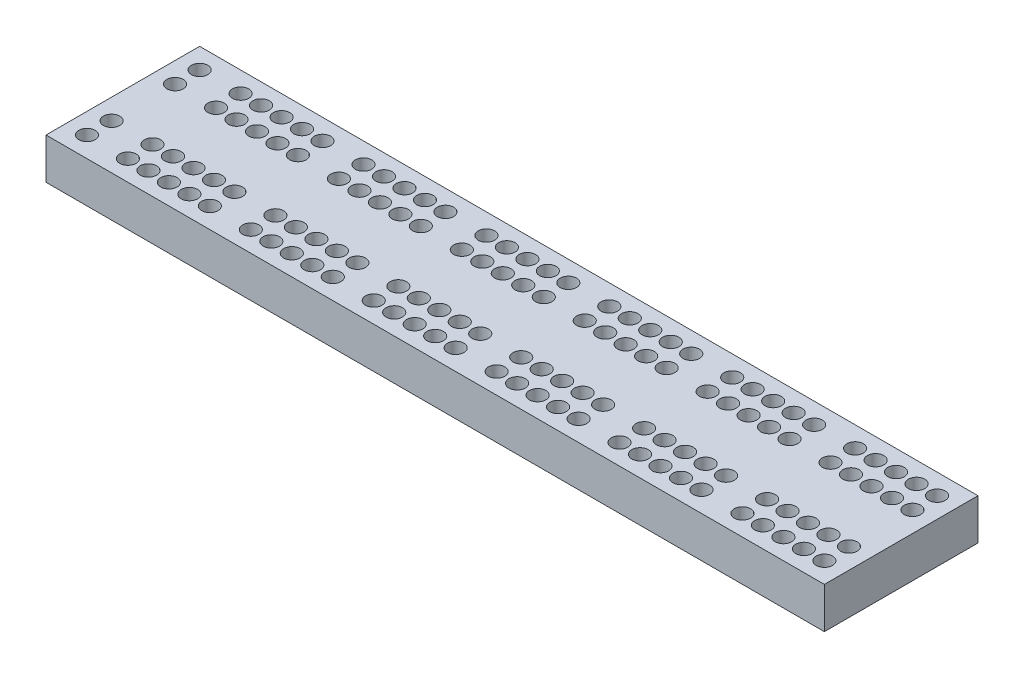
from build123d import *

# Parameters (mm, degrees)
SKETCH1_W            = 75
SKETCH1_H            = 20
BOSS_EXTRUDE1_DEPTH  = 190
LPATTERN1_COUNT      = 37
LPATTERN1_PITCH      = 10
LPATTERN1_COUNT_DIR2 = 2
LPATTERN1_PITCH_DIR2 = 12


with BuildPart() as part:
    # Sketch1 → Boss-Extrude1 (new, symmetric)
    with BuildSketch(Plane(origin=(0, 0, 0), x_dir=(0, 0, -1), z_dir=(1, 0, 0))):
        Rectangle(SKETCH1_W, SKETCH1_H)
    extrude(amount=BOSS_EXTRUDE1_DEPTH, both=True)

    # Sketch2 → Ø8.0 (8) Diameter Hole1 (revolve, cut)
    with BuildSketch(Plane(origin=(-180, 10, -27.5), x_dir=(0, 0, 1), z_dir=(1, 0, 0))):
        Polygon((0, 0), (0, 14.403442476), (4, 12), (4, 0), align=None)
    f_8_0_8_diameter_hole1 = revolve(axis=Axis((-180, 16.35, -27.5), (0, -1, 0)), mode=Mode.SUBTRACT)

    # LPattern1: 8.0 _8_ Diameter Hole1 37 × 2, 12 skipped
    with Locations(*[(i * LPATTERN1_PITCH, 0, j * LPATTERN1_PITCH_DIR2) for i in range(LPATTERN1_COUNT) for j in range(LPATTERN1_COUNT_DIR2) if (i, j) not in ((0, 0), (1, 0), (1, 1), (7, 0), (7, 1), (13, 0), (13, 1), (19, 0), (19, 1), (25, 0), (25, 1), (31, 0), (31, 1))]):
        add(f_8_0_8_diameter_hole1, mode=Mode.SUBTRACT)

    # Mirror1: Ø8.0 (8) Diameter Hole1 across plane
    add(f_8_0_8_diameter_hole1.mirror(Plane.XY), mode=Mode.SUBTRACT)

    # Mirror1 copy 1 sketch → Mirror1 copy 1 (revolve, cut)
    with BuildSketch(Plane(origin=(-180, 10, 15.5), x_dir=(0, 0, -1), z_dir=(1, 0, 0))):
        Polygon((0, 0), (0, -14.403442476), (4, -12), (4, 0), align=None)
    revolve(axis=Axis((-180, 16.35, 15.5), (0, 1, 0)), mode=Mode.SUBTRACT)

    # Mirror1 copy 2 sketch → Mirror1 copy 2 (revolve, cut)
    with BuildSketch(Plane(origin=(-160, 10, 27.5), x_dir=(0, 0, -1), z_dir=(1, 0, 0))):
        Polygon((0, 0), (0, -14.403442476), (4, -12), (4, 0), align=None)
    revolve(axis=Axis((-160, 16.35, 27.5), (0, 1, 0)), mode=Mode.SUBTRACT)

    # Mirror1 copy 3 sketch → Mirror1 copy 3 (revolve, cut)
    with BuildSketch(Plane(origin=(-160, 10, 15.5), x_dir=(0, 0, -1), z_dir=(1, 0, 0))):
        Polygon((0, 0), (0, -14.403442476), (4, -12), (4, 0), align=None)
    revolve(axis=Axis((-160, 16.35, 15.5), (0, 1, 0)), mode=Mode.SUBTRACT)

    # Mirror1 copy 4 sketch → Mirror1 copy 4 (revolve, cut)
    with BuildSketch(Plane(origin=(-150, 10, 27.5), x_dir=(0, 0, -1), z_dir=(1, 0, 0))):
        Polygon((0, 0), (0, -14.403442476), (4, -12), (4, 0), align=None)
    revolve(axis=Axis((-150, 16.35, 27.5), (0, 1, 0)), mode=Mode.SUBTRACT)

    # Mirror1 copy 5 sketch → Mirror1 copy 5 (revolve, cut)
    with BuildSketch(Plane(origin=(-150, 10, 15.5), x_dir=(0, 0, -1), z_dir=(1, 0, 0))):
        Polygon((0, 0), (0, -14.403442476), (4, -12), (4, 0), align=None)
    revolve(axis=Axis((-150, 16.35, 15.5), (0, 1, 0)), mode=Mode.SUBTRACT)

    # Mirror1 copy 6 sketch → Mirror1 copy 6 (revolve, cut)
    with BuildSketch(Plane(origin=(-140, 10, 27.5), x_dir=(0, 0, -1), z_dir=(1, 0, 0))):
        Polygon((0, 0), (0, -14.403442476), (4, -12), (4, 0), align=None)
    revolve(axis=Axis((-140, 16.35, 27.5), (0, 1, 0)), mode=Mode.SUBTRACT)

    # Mirror1 copy 7 sketch → Mirror1 copy 7 (revolve, cut)
    with BuildSketch(Plane(origin=(-140, 10, 15.5), x_dir=(0, 0, -1), z_dir=(1, 0, 0))):
        Polygon((0, 0), (0, -14.403442476), (4, -12), (4, 0), align=None)
    revolve(axis=Axis((-140, 16.35, 15.5), (0, 1, 0)), mode=Mode.SUBTRACT)

    # Mirror1 copy 8 sketch → Mirror1 copy 8 (revolve, cut)
    with BuildSketch(Plane(origin=(-130, 10, 27.5), x_dir=(0, 0, -1), z_dir=(1, 0, 0))):
        Polygon((0, 0), (0, -14.403442476), (4, -12), (4, 0), align=None)
    revolve(axis=Axis((-130, 16.35, 27.5), (0, 1, 0)), mode=Mode.SUBTRACT)

    # Mirror1 copy 9 sketch → Mirror1 copy 9 (revolve, cut)
    with BuildSketch(Plane(origin=(-130, 10, 15.5), x_dir=(0, 0, -1), z_dir=(1, 0, 0))):
        Polygon((0, 0), (0, -14.403442476), (4, -12), (4, 0), align=None)
    revolve(axis=Axis((-130, 16.35, 15.5), (0, 1, 0)), mode=Mode.SUBTRACT)

    # Mirror1 copy 10 sketch → Mirror1 copy 10 (revolve, cut)
    with BuildSketch(Plane(origin=(-120, 10, 27.5), x_dir=(0, 0, -1), z_dir=(1, 0, 0))):
        Polygon((0, 0), (0, -14.403442476), (4, -12), (4, 0), align=None)
    revolve(axis=Axis((-120, 16.35, 27.5), (0, 1, 0)), mode=Mode.SUBTRACT)

    # Mirror1 copy 11 sketch → Mirror1 copy 11 (revolve, cut)
    with BuildSketch(Plane(origin=(-120, 10, 15.5), x_dir=(0, 0, -1), z_dir=(1, 0, 0))):
        Polygon((0, 0), (0, -14.403442476), (4, -12), (4, 0), align=None)
    revolve(axis=Axis((-120, 16.35, 15.5), (0, 1, 0)), mode=Mode.SUBTRACT)

    # Mirror1 copy 12 sketch → Mirror1 copy 12 (revolve, cut)
    with BuildSketch(Plane(origin=(-100, 10, 27.5), x_dir=(0, 0, -1), z_dir=(1, 0, 0))):
        Polygon((0, 0), (0, -14.403442476), (4, -12), (4, 0), align=None)
    revolve(axis=Axis((-100, 16.35, 27.5), (0, 1, 0)), mode=Mode.SUBTRACT)

    # Mirror1 copy 13 sketch → Mirror1 copy 13 (revolve, cut)
    with BuildSketch(Plane(origin=(-100, 10, 15.5), x_dir=(0, 0, -1), z_dir=(1, 0, 0))):
        Polygon((0, 0), (0, -14.403442476), (4, -12), (4, 0), align=None)
    revolve(axis=Axis((-100, 16.35, 15.5), (0, 1, 0)), mode=Mode.SUBTRACT)

    # Mirror1 copy 14 sketch → Mirror1 copy 14 (revolve, cut)
    with BuildSketch(Plane(origin=(-90, 10, 27.5), x_dir=(0, 0, -1), z_dir=(1, 0, 0))):
        Polygon((0, 0), (0, -14.403442476), (4, -12), (4, 0), align=None)
    revolve(axis=Axis((-90, 16.35, 27.5), (0, 1, 0)), mode=Mode.SUBTRACT)

    # Mirror1 copy 15 sketch → Mirror1 copy 15 (revolve, cut)
    with BuildSketch(Plane(origin=(-90, 10, 15.5), x_dir=(0, 0, -1), z_dir=(1, 0, 0))):
        Polygon((0, 0), (0, -14.403442476), (4, -12), (4, 0), align=None)
    revolve(axis=Axis((-90, 16.35, 15.5), (0, 1, 0)), mode=Mode.SUBTRACT)

    # Mirror1 copy 16 sketch → Mirror1 copy 16 (revolve, cut)
    with BuildSketch(Plane(origin=(-80, 10, 27.5), x_dir=(0, 0, -1), z_dir=(1, 0, 0))):
        Polygon((0, 0), (0, -14.403442476), (4, -12), (4, 0), align=None)
    revolve(axis=Axis((-80, 16.35, 27.5), (0, 1, 0)), mode=Mode.SUBTRACT)

    # Mirror1 copy 17 sketch → Mirror1 copy 17 (revolve, cut)
    with BuildSketch(Plane(origin=(-80, 10, 15.5), x_dir=(0, 0, -1), z_dir=(1, 0, 0))):
        Polygon((0, 0), (0, -14.403442476), (4, -12), (4, 0), align=None)
    revolve(axis=Axis((-80, 16.35, 15.5), (0, 1, 0)), mode=Mode.SUBTRACT)

    # Mirror1 copy 18 sketch → Mirror1 copy 18 (revolve, cut)
    with BuildSketch(Plane(origin=(-70, 10, 27.5), x_dir=(0, 0, -1), z_dir=(1, 0, 0))):
        Polygon((0, 0), (0, -14.403442476), (4, -12), (4, 0), align=None)
    revolve(axis=Axis((-70, 16.35, 27.5), (0, 1, 0)), mode=Mode.SUBTRACT)

    # Mirror1 copy 19 sketch → Mirror1 copy 19 (revolve, cut)
    with BuildSketch(Plane(origin=(-70, 10, 15.5), x_dir=(0, 0, -1), z_dir=(1, 0, 0))):
        Polygon((0, 0), (0, -14.403442476), (4, -12), (4, 0), align=None)
    revolve(axis=Axis((-70, 16.35, 15.5), (0, 1, 0)), mode=Mode.SUBTRACT)

    # Mirror1 copy 20 sketch → Mirror1 copy 20 (revolve, cut)
    with BuildSketch(Plane(origin=(-60, 10, 27.5), x_dir=(0, 0, -1), z_dir=(1, 0, 0))):
        Polygon((0, 0), (0, -14.403442476), (4, -12), (4, 0), align=None)
    revolve(axis=Axis((-60, 16.35, 27.5), (0, 1, 0)), mode=Mode.SUBTRACT)

    # Mirror1 copy 21 sketch → Mirror1 copy 21 (revolve, cut)
    with BuildSketch(Plane(origin=(-60, 10, 15.5), x_dir=(0, 0, -1), z_dir=(1, 0, 0))):
        Polygon((0, 0), (0, -14.403442476), (4, -12), (4, 0), align=None)
    revolve(axis=Axis((-60, 16.35, 15.5), (0, 1, 0)), mode=Mode.SUBTRACT)

    # Mirror1 copy 22 sketch → Mirror1 copy 22 (revolve, cut)
    with BuildSketch(Plane(origin=(-40, 10, 27.5), x_dir=(0, 0, -1), z_dir=(1, 0, 0))):
        Polygon((0, 0), (0, -14.403442476), (4, -12), (4, 0), align=None)
    revolve(axis=Axis((-40, 16.35, 27.5), (0, 1, 0)), mode=Mode.SUBTRACT)

    # Mirror1 copy 23 sketch → Mirror1 copy 23 (revolve, cut)
    with BuildSketch(Plane(origin=(-40, 10, 15.5), x_dir=(0, 0, -1), z_dir=(1, 0, 0))):
        Polygon((0, 0), (0, -14.403442476), (4, -12), (4, 0), align=None)
    revolve(axis=Axis((-40, 16.35, 15.5), (0, 1, 0)), mode=Mode.SUBTRACT)

    # Mirror1 copy 24 sketch → Mirror1 copy 24 (revolve, cut)
    with BuildSketch(Plane(origin=(-30, 10, 27.5), x_dir=(0, 0, -1), z_dir=(1, 0, 0))):
        Polygon((0, 0), (0, -14.403442476), (4, -12), (4, 0), align=None)
    revolve(axis=Axis((-30, 16.35, 27.5), (0, 1, 0)), mode=Mode.SUBTRACT)

    # Mirror1 copy 25 sketch → Mirror1 copy 25 (revolve, cut)
    with BuildSketch(Plane(origin=(-30, 10, 15.5), x_dir=(0, 0, -1), z_dir=(1, 0, 0))):
        Polygon((0, 0), (0, -14.403442476), (4, -12), (4, 0), align=None)
    revolve(axis=Axis((-30, 16.35, 15.5), (0, 1, 0)), mode=Mode.SUBTRACT)

    # Mirror1 copy 26 sketch → Mirror1 copy 26 (revolve, cut)
    with BuildSketch(Plane(origin=(-20, 10, 27.5), x_dir=(0, 0, -1), z_dir=(1, 0, 0))):
        Polygon((0, 0), (0, -14.403442476), (4, -12), (4, 0), align=None)
    revolve(axis=Axis((-20, 16.35, 27.5), (0, 1, 0)), mode=Mode.SUBTRACT)

    # Mirror1 copy 27 sketch → Mirror1 copy 27 (revolve, cut)
    with BuildSketch(Plane(origin=(-20, 10, 15.5), x_dir=(0, 0, -1), z_dir=(1, 0, 0))):
        Polygon((0, 0), (0, -14.403442476), (4, -12), (4, 0), align=None)
    revolve(axis=Axis((-20, 16.35, 15.5), (0, 1, 0)), mode=Mode.SUBTRACT)

    # Mirror1 copy 28 sketch → Mirror1 copy 28 (revolve, cut)
    with BuildSketch(Plane(origin=(-10, 10, 27.5), x_dir=(0, 0, -1), z_dir=(1, 0, 0))):
        Polygon((0, 0), (0, -14.403442476), (4, -12), (4, 0), align=None)
    revolve(axis=Axis((-10, 16.35, 27.5), (0, 1, 0)), mode=Mode.SUBTRACT)

    # Mirror1 copy 29 sketch → Mirror1 copy 29 (revolve, cut)
    with BuildSketch(Plane(origin=(-10, 10, 15.5), x_dir=(0, 0, -1), z_dir=(1, 0, 0))):
        Polygon((0, 0), (0, -14.403442476), (4, -12), (4, 0), align=None)
    revolve(axis=Axis((-10, 16.35, 15.5), (0, 1, 0)), mode=Mode.SUBTRACT)

    # Mirror1 copy 30 sketch → Mirror1 copy 30 (revolve, cut)
    with BuildSketch(Plane(origin=(0, 10, 27.5), x_dir=(0, 0, -1), z_dir=(1, 0, 0))):
        Polygon((0, 0), (0, -14.403442476), (4, -12), (4, 0), align=None)
    revolve(axis=Axis((0, 16.35, 27.5), (0, 1, 0)), mode=Mode.SUBTRACT)

    # Mirror1 copy 31 sketch → Mirror1 copy 31 (revolve, cut)
    with BuildSketch(Plane(origin=(0, 10, 15.5), x_dir=(0, 0, -1), z_dir=(1, 0, 0))):
        Polygon((0, 0), (0, -14.403442476), (4, -12), (4, 0), align=None)
    revolve(axis=Axis((0, 16.35, 15.5), (0, 1, 0)), mode=Mode.SUBTRACT)

    # Mirror1 copy 32 sketch → Mirror1 copy 32 (revolve, cut)
    with BuildSketch(Plane(origin=(20, 10, 27.5), x_dir=(0, 0, -1), z_dir=(1, 0, 0))):
        Polygon((0, 0), (0, -14.403442476), (4, -12), (4, 0), align=None)
    revolve(axis=Axis((20, 16.35, 27.5), (0, 1, 0)), mode=Mode.SUBTRACT)

    # Mirror1 copy 33 sketch → Mirror1 copy 33 (revolve, cut)
    with BuildSketch(Plane(origin=(20, 10, 15.5), x_dir=(0, 0, -1), z_dir=(1, 0, 0))):
        Polygon((0, 0), (0, -14.403442476), (4, -12), (4, 0), align=None)
    revolve(axis=Axis((20, 16.35, 15.5), (0, 1, 0)), mode=Mode.SUBTRACT)

    # Mirror1 copy 34 sketch → Mirror1 copy 34 (revolve, cut)
    with BuildSketch(Plane(origin=(30, 10, 27.5), x_dir=(0, 0, -1), z_dir=(1, 0, 0))):
        Polygon((0, 0), (0, -14.403442476), (4, -12), (4, 0), align=None)
    revolve(axis=Axis((30, 16.35, 27.5), (0, 1, 0)), mode=Mode.SUBTRACT)

    # Mirror1 copy 35 sketch → Mirror1 copy 35 (revolve, cut)
    with BuildSketch(Plane(origin=(30, 10, 15.5), x_dir=(0, 0, -1), z_dir=(1, 0, 0))):
        Polygon((0, 0), (0, -14.403442476), (4, -12), (4, 0), align=None)
    revolve(axis=Axis((30, 16.35, 15.5), (0, 1, 0)), mode=Mode.SUBTRACT)

    # Mirror1 copy 36 sketch → Mirror1 copy 36 (revolve, cut)
    with BuildSketch(Plane(origin=(40, 10, 27.5), x_dir=(0, 0, -1), z_dir=(1, 0, 0))):
        Polygon((0, 0), (0, -14.403442476), (4, -12), (4, 0), align=None)
    revolve(axis=Axis((40, 16.35, 27.5), (0, 1, 0)), mode=Mode.SUBTRACT)

    # Mirror1 copy 37 sketch → Mirror1 copy 37 (revolve, cut)
    with BuildSketch(Plane(origin=(40, 10, 15.5), x_dir=(0, 0, -1), z_dir=(1, 0, 0))):
        Polygon((0, 0), (0, -14.403442476), (4, -12), (4, 0), align=None)
    revolve(axis=Axis((40, 16.35, 15.5), (0, 1, 0)), mode=Mode.SUBTRACT)

    # Mirror1 copy 38 sketch → Mirror1 copy 38 (revolve, cut)
    with BuildSketch(Plane(origin=(50, 10, 27.5), x_dir=(0, 0, -1), z_dir=(1, 0, 0))):
        Polygon((0, 0), (0, -14.403442476), (4, -12), (4, 0), align=None)
    revolve(axis=Axis((50, 16.35, 27.5), (0, 1, 0)), mode=Mode.SUBTRACT)

    # Mirror1 copy 39 sketch → Mirror1 copy 39 (revolve, cut)
    with BuildSketch(Plane(origin=(50, 10, 15.5), x_dir=(0, 0, -1), z_dir=(1, 0, 0))):
        Polygon((0, 0), (0, -14.403442476), (4, -12), (4, 0), align=None)
    revolve(axis=Axis((50, 16.35, 15.5), (0, 1, 0)), mode=Mode.SUBTRACT)

    # Mirror1 copy 40 sketch → Mirror1 copy 40 (revolve, cut)
    with BuildSketch(Plane(origin=(60, 10, 27.5), x_dir=(0, 0, -1), z_dir=(1, 0, 0))):
        Polygon((0, 0), (0, -14.403442476), (4, -12), (4, 0), align=None)
    revolve(axis=Axis((60, 16.35, 27.5), (0, 1, 0)), mode=Mode.SUBTRACT)

    # Mirror1 copy 41 sketch → Mirror1 copy 41 (revolve, cut)
    with BuildSketch(Plane(origin=(60, 10, 15.5), x_dir=(0, 0, -1), z_dir=(1, 0, 0))):
        Polygon((0, 0), (0, -14.403442476), (4, -12), (4, 0), align=None)
    revolve(axis=Axis((60, 16.35, 15.5), (0, 1, 0)), mode=Mode.SUBTRACT)

    # Mirror1 copy 42 sketch → Mirror1 copy 42 (revolve, cut)
    with BuildSketch(Plane(origin=(80, 10, 27.5), x_dir=(0, 0, -1), z_dir=(1, 0, 0))):
        Polygon((0, 0), (0, -14.403442476), (4, -12), (4, 0), align=None)
    revolve(axis=Axis((80, 16.35, 27.5), (0, 1, 0)), mode=Mode.SUBTRACT)

    # Mirror1 copy 43 sketch → Mirror1 copy 43 (revolve, cut)
    with BuildSketch(Plane(origin=(80, 10, 15.5), x_dir=(0, 0, -1), z_dir=(1, 0, 0))):
        Polygon((0, 0), (0, -14.403442476), (4, -12), (4, 0), align=None)
    revolve(axis=Axis((80, 16.35, 15.5), (0, 1, 0)), mode=Mode.SUBTRACT)

    # Mirror1 copy 44 sketch → Mirror1 copy 44 (revolve, cut)
    with BuildSketch(Plane(origin=(90, 10, 27.5), x_dir=(0, 0, -1), z_dir=(1, 0, 0))):
        Polygon((0, 0), (0, -14.403442476), (4, -12), (4, 0), align=None)
    revolve(axis=Axis((90, 16.35, 27.5), (0, 1, 0)), mode=Mode.SUBTRACT)

    # Mirror1 copy 45 sketch → Mirror1 copy 45 (revolve, cut)
    with BuildSketch(Plane(origin=(90, 10, 15.5), x_dir=(0, 0, -1), z_dir=(1, 0, 0))):
        Polygon((0, 0), (0, -14.403442476), (4, -12), (4, 0), align=None)
    revolve(axis=Axis((90, 16.35, 15.5), (0, 1, 0)), mode=Mode.SUBTRACT)

    # Mirror1 copy 46 sketch → Mirror1 copy 46 (revolve, cut)
    with BuildSketch(Plane(origin=(100, 10, 27.5), x_dir=(0, 0, -1), z_dir=(1, 0, 0))):
        Polygon((0, 0), (0, -14.403442476), (4, -12), (4, 0), align=None)
    revolve(axis=Axis((100, 16.35, 27.5), (0, 1, 0)), mode=Mode.SUBTRACT)

    # Mirror1 copy 47 sketch → Mirror1 copy 47 (revolve, cut)
    with BuildSketch(Plane(origin=(100, 10, 15.5), x_dir=(0, 0, -1), z_dir=(1, 0, 0))):
        Polygon((0, 0), (0, -14.403442476), (4, -12), (4, 0), align=None)
    revolve(axis=Axis((100, 16.35, 15.5), (0, 1, 0)), mode=Mode.SUBTRACT)

    # Mirror1 copy 48 sketch → Mirror1 copy 48 (revolve, cut)
    with BuildSketch(Plane(origin=(110, 10, 27.5), x_dir=(0, 0, -1), z_dir=(1, 0, 0))):
        Polygon((0, 0), (0, -14.403442476), (4, -12), (4, 0), align=None)
    revolve(axis=Axis((110, 16.35, 27.5), (0, 1, 0)), mode=Mode.SUBTRACT)

    # Mirror1 copy 49 sketch → Mirror1 copy 49 (revolve, cut)
    with BuildSketch(Plane(origin=(110, 10, 15.5), x_dir=(0, 0, -1), z_dir=(1, 0, 0))):
        Polygon((0, 0), (0, -14.403442476), (4, -12), (4, 0), align=None)
    revolve(axis=Axis((110, 16.35, 15.5), (0, 1, 0)), mode=Mode.SUBTRACT)

    # Mirror1 copy 50 sketch → Mirror1 copy 50 (revolve, cut)
    with BuildSketch(Plane(origin=(120, 10, 27.5), x_dir=(0, 0, -1), z_dir=(1, 0, 0))):
        Polygon((0, 0), (0, -14.403442476), (4, -12), (4, 0), align=None)
    revolve(axis=Axis((120, 16.35, 27.5), (0, 1, 0)), mode=Mode.SUBTRACT)

    # Mirror1 copy 51 sketch → Mirror1 copy 51 (revolve, cut)
    with BuildSketch(Plane(origin=(120, 10, 15.5), x_dir=(0, 0, -1), z_dir=(1, 0, 0))):
        Polygon((0, 0), (0, -14.403442476), (4, -12), (4, 0), align=None)
    revolve(axis=Axis((120, 16.35, 15.5), (0, 1, 0)), mode=Mode.SUBTRACT)

    # Mirror1 copy 52 sketch → Mirror1 copy 52 (revolve, cut)
    with BuildSketch(Plane(origin=(140, 10, 27.5), x_dir=(0, 0, -1), z_dir=(1, 0, 0))):
        Polygon((0, 0), (0, -14.403442476), (4, -12), (4, 0), align=None)
    revolve(axis=Axis((140, 16.35, 27.5), (0, 1, 0)), mode=Mode.SUBTRACT)

    # Mirror1 copy 53 sketch → Mirror1 copy 53 (revolve, cut)
    with BuildSketch(Plane(origin=(140, 10, 15.5), x_dir=(0, 0, -1), z_dir=(1, 0, 0))):
        Polygon((0, 0), (0, -14.403442476), (4, -12), (4, 0), align=None)
    revolve(axis=Axis((140, 16.35, 15.5), (0, 1, 0)), mode=Mode.SUBTRACT)

    # Mirror1 copy 54 sketch → Mirror1 copy 54 (revolve, cut)
    with BuildSketch(Plane(origin=(150, 10, 27.5), x_dir=(0, 0, -1), z_dir=(1, 0, 0))):
        Polygon((0, 0), (0, -14.403442476), (4, -12), (4, 0), align=None)
    revolve(axis=Axis((150, 16.35, 27.5), (0, 1, 0)), mode=Mode.SUBTRACT)

    # Mirror1 copy 55 sketch → Mirror1 copy 55 (revolve, cut)
    with BuildSketch(Plane(origin=(150, 10, 15.5), x_dir=(0, 0, -1), z_dir=(1, 0, 0))):
        Polygon((0, 0), (0, -14.403442476), (4, -12), (4, 0), align=None)
    revolve(axis=Axis((150, 16.35, 15.5), (0, 1, 0)), mode=Mode.SUBTRACT)

    # Mirror1 copy 56 sketch → Mirror1 copy 56 (revolve, cut)
    with BuildSketch(Plane(origin=(160, 10, 27.5), x_dir=(0, 0, -1), z_dir=(1, 0, 0))):
        Polygon((0, 0), (0, -14.403442476), (4, -12), (4, 0), align=None)
    revolve(axis=Axis((160, 16.35, 27.5), (0, 1, 0)), mode=Mode.SUBTRACT)

    # Mirror1 copy 57 sketch → Mirror1 copy 57 (revolve, cut)
    with BuildSketch(Plane(origin=(160, 10, 15.5), x_dir=(0, 0, -1), z_dir=(1, 0, 0))):
        Polygon((0, 0), (0, -14.403442476), (4, -12), (4, 0), align=None)
    revolve(axis=Axis((160, 16.35, 15.5), (0, 1, 0)), mode=Mode.SUBTRACT)

    # Mirror1 copy 58 sketch → Mirror1 copy 58 (revolve, cut)
    with BuildSketch(Plane(origin=(170, 10, 27.5), x_dir=(0, 0, -1), z_dir=(1, 0, 0))):
        Polygon((0, 0), (0, -14.403442476), (4, -12), (4, 0), align=None)
    revolve(axis=Axis((170, 16.35, 27.5), (0, 1, 0)), mode=Mode.SUBTRACT)

    # Mirror1 copy 59 sketch → Mirror1 copy 59 (revolve, cut)
    with BuildSketch(Plane(origin=(170, 10, 15.5), x_dir=(0, 0, -1), z_dir=(1, 0, 0))):
        Polygon((0, 0), (0, -14.403442476), (4, -12), (4, 0), align=None)
    revolve(axis=Axis((170, 16.35, 15.5), (0, 1, 0)), mode=Mode.SUBTRACT)

    # Mirror1 copy 60 sketch → Mirror1 copy 60 (revolve, cut)
    with BuildSketch(Plane(origin=(180, 10, 27.5), x_dir=(0, 0, -1), z_dir=(1, 0, 0))):
        Polygon((0, 0), (0, -14.403442476), (4, -12), (4, 0), align=None)
    revolve(axis=Axis((180, 16.35, 27.5), (0, 1, 0)), mode=Mode.SUBTRACT)

    # Mirror1 copy 61 sketch → Mirror1 copy 61 (revolve, cut)
    with BuildSketch(Plane(origin=(180, 10, 15.5), x_dir=(0, 0, -1), z_dir=(1, 0, 0))):
        Polygon((0, 0), (0, -14.403442476), (4, -12), (4, 0), align=None)
    revolve(axis=Axis((180, 16.35, 15.5), (0, 1, 0)), mode=Mode.SUBTRACT)


solid = part.part
